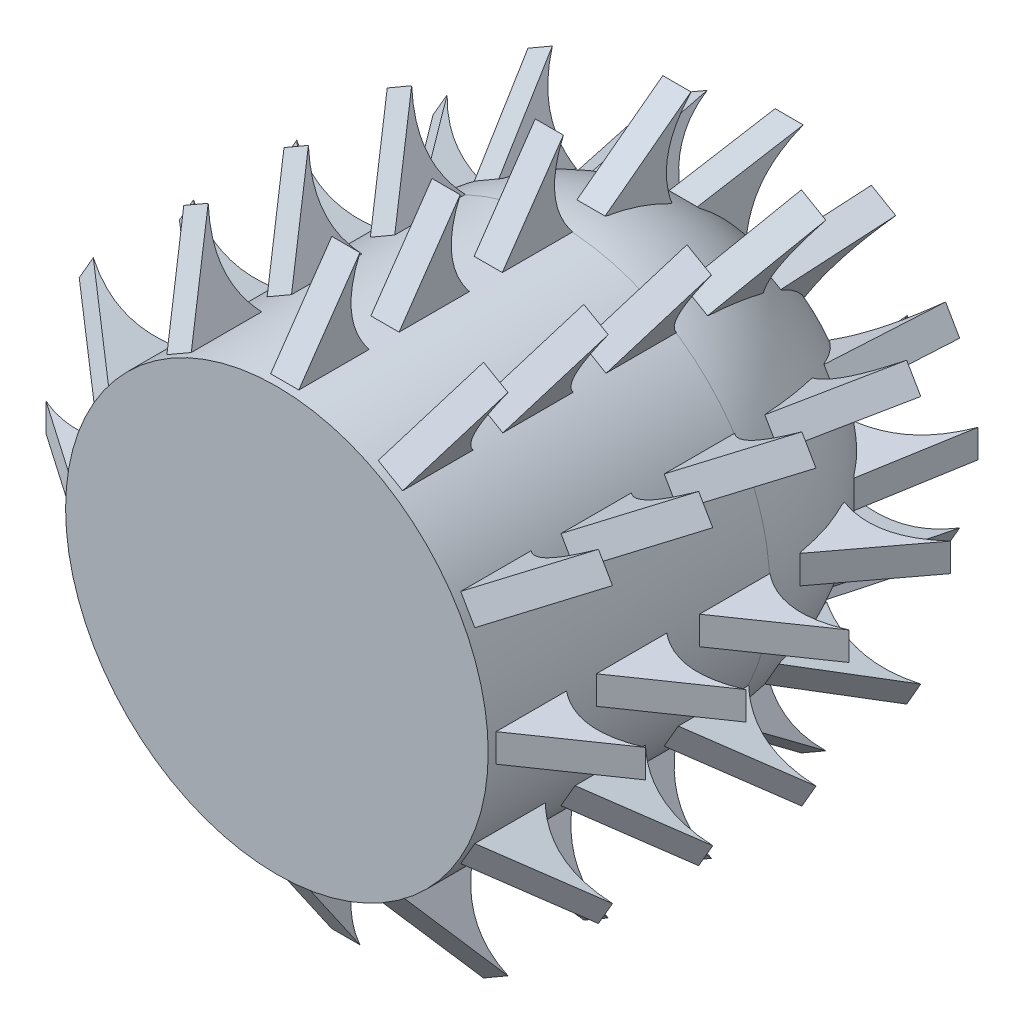
from build123d import *

# Parameters (mm, degrees)
SKETCH_1_R               = 15
EXTRUDE_1_DEPTH          = 20
EXTRUDE_2_DEPTH          = 1
EXTRUDE_2_2_DEPTH        = 1
EXTRUDE_2_3_DEPTH        = 1
EXTRUDE_2_4_DEPTH        = 1
EXTRUDE_2_5_DEPTH        = 1
EXTRUDE_2_6_DEPTH        = 1
PATTERN_CIRCULAR_3_COUNT = 12
PATTERN_CIRCULAR_4_COUNT = 3


with BuildPart() as part:
    # 스케치1 → 보스-돌출1 (new body)
    with BuildSketch(Plane.XY):
        Circle(SKETCH_1_R)
    extrude(amount=EXTRUDE_1_DEPTH)

    # 스케치3 → 회전1 (revolve)
    with BuildSketch(Plane(origin=(0, 0, 0), x_dir=(0, 0, -1), z_dir=(1, 0, 0)), mode=Mode.PRIVATE) as revolve_1_sk:
        with BuildLine():
            Line((0, 15), (0, 0))
            Line((0, 0), (15, 0))
            ThreePointArc((15, 0), (10.606601718, 10.606601718), (0, 15))
        make_face()
    revolve(revolve_1_sk.sketch.rotate(Axis((0, 0, 0), (0, 0, -1)), 180), axis=Axis((0, 0, 0), (0, 0, -1)))


with BuildPart() as body_2:
    # 스케치2 → 보스-돌출2 (new, symmetric)
    with BuildSketch(Plane(origin=(0, 0, 0), x_dir=(1, 0, 0), z_dir=(0, 1, 0))):
        with BuildLine():
            Line((15, -12.327226988), (15, -7.327226988))
            add(Edge.make_bspline(
                [(21.278081575, -7.989280406), (17.730527415, -9.527850561), (15, -7.327226988)],
                knots=[0, 0, 0, 1, 1, 1], degree=2))
            Line((21.278081575, -7.989280406), (15, -12.327226988))
        make_face()
    extrude(amount=EXTRUDE_2_DEPTH, both=True)


with BuildPart() as body_3:
    # 스케치2 → Extrude 2 2 (new, symmetric)
    with BuildSketch(Plane(origin=(0, 0, 0), x_dir=(1, 0, 0), z_dir=(0, 1, 0))):
        with BuildLine():
            Line((15, -5), (15, 0))
            add(Edge.make_bspline(
                [(21.278081575, -0.662053418), (17.730527415, -2.200623572), (15, 0)],
                knots=[0, 0, 0, 1, 1, 1], degree=2))
            Line((21.278081575, -0.662053418), (15, -5))
        make_face()
    extrude(amount=EXTRUDE_2_2_DEPTH, both=True)


with BuildPart() as body_4:
    # 스케치2 → Extrude 2 3 (new, symmetric)
    with BuildSketch(Plane(origin=(0, 0, 0), x_dir=(1, 0, 0), z_dir=(0, 1, 0))):
        with BuildLine():
            Line((12.116597052, 8.842402156), (8.537210737, 12.333532861))
            add(Edge.make_bspline(
                [(13.394680398, 16.365605713), (12.019112737, 12.751722449), (8.537210737, 12.333532861)],
                knots=[0, 0, 0, 1, 1, 1], degree=2))
            Line((13.394680398, 16.365605713), (12.116597052, 8.842402156))
        make_face()
    extrude(amount=EXTRUDE_2_3_DEPTH, both=True)


with BuildPart() as body_5:
    # 스케치2 → Extrude 2 4 (new, symmetric)
    with BuildSketch(Plane(origin=(0, 0, 0), x_dir=(1, 0, 0), z_dir=(0, 1, 0))):
        with BuildLine():
            Line((14.823269639, 2.295795553), (13.245193011, 7.040231679))
            add(Edge.make_bspline(
                [(19.411338622, 8.393476408), (16.530706118, 5.813884383), (13.245193011, 7.040231679)],
                knots=[0, 0, 0, 1, 1, 1], degree=2))
            Line((19.411338622, 8.393476408), (14.823269639, 2.295795553))
        make_face()
    extrude(amount=EXTRUDE_2_4_DEPTH, both=True)


with BuildPart() as body_6:
    # 스케치2 → Extrude 2 5 (new, symmetric)
    with BuildSketch(Plane(origin=(0, 0, 0), x_dir=(1, 0, 0), z_dir=(0, 1, 0))):
        with BuildLine():
            Line((15, -19.442457978), (15, -14.442457978))
            add(Edge.make_bspline(
                [(21.278081575, -15.104511396), (17.730527415, -16.64308155), (15, -14.442457978)],
                knots=[0, 0, 0, 1, 1, 1], degree=2))
            Line((21.278081575, -15.104511396), (15, -19.442457978))
        make_face()
    extrude(amount=EXTRUDE_2_5_DEPTH, both=True)


with BuildPart() as body_7:
    # 스케치2 → Extrude 2 6 (new, symmetric)
    with BuildSketch(Plane(origin=(0, 0, 0), x_dir=(1, 0, 0), z_dir=(0, 1, 0))):
        with BuildLine():
            Line((6.460353009, 13.537497516), (1.652060322, 14.908745645))
            add(Edge.make_bspline(
                [(4.010491166, 20.764548488), (4.51715489, 16.931060454), (1.652060322, 14.908745645)],
                knots=[0, 0, 0, 1, 1, 1], degree=2))
            Line((4.010491166, 20.764548488), (6.460353009, 13.537497516))
        make_face()
    extrude(amount=EXTRUDE_2_6_DEPTH, both=True)


with BuildPart() as pattern_circular_3_1:
    # 원형 패턴3: pattern copy
    add(body_3.part.rotate(Axis((0, 0, 20), (0, 0, -1)), 1 * 360 / PATTERN_CIRCULAR_3_COUNT))


with BuildPart() as pattern_circular_3_2:
    # 원형 패턴3: pattern copy
    add(body_3.part.rotate(Axis((0, 0, 20), (0, 0, -1)), 2 * 360 / PATTERN_CIRCULAR_3_COUNT))


with BuildPart() as pattern_circular_3_3:
    # 원형 패턴3: pattern copy
    add(body_3.part.rotate(Axis((0, 0, 20), (0, 0, -1)), 3 * 360 / PATTERN_CIRCULAR_3_COUNT))


with BuildPart() as pattern_circular_3_4:
    # 원형 패턴3: pattern copy
    add(body_3.part.rotate(Axis((0, 0, 20), (0, 0, -1)), 4 * 360 / PATTERN_CIRCULAR_3_COUNT))


with BuildPart() as pattern_circular_3_5:
    # 원형 패턴3: pattern copy
    add(body_3.part.rotate(Axis((0, 0, 20), (0, 0, -1)), 5 * 360 / PATTERN_CIRCULAR_3_COUNT))


with BuildPart() as pattern_circular_3_6:
    # 원형 패턴3: pattern copy
    add(body_3.part.rotate(Axis((0, 0, 20), (0, 0, -1)), 6 * 360 / PATTERN_CIRCULAR_3_COUNT))


with BuildPart() as pattern_circular_3_7:
    # 원형 패턴3: pattern copy
    add(body_3.part.rotate(Axis((0, 0, 20), (0, 0, -1)), 7 * 360 / PATTERN_CIRCULAR_3_COUNT))


with BuildPart() as pattern_circular_3_8:
    # 원형 패턴3: pattern copy
    add(body_3.part.rotate(Axis((0, 0, 20), (0, 0, -1)), 8 * 360 / PATTERN_CIRCULAR_3_COUNT))


with BuildPart() as pattern_circular_3_9:
    # 원형 패턴3: pattern copy
    add(body_3.part.rotate(Axis((0, 0, 20), (0, 0, -1)), 9 * 360 / PATTERN_CIRCULAR_3_COUNT))


with BuildPart() as pattern_circular_3_10:
    # 원형 패턴3: pattern copy
    add(body_3.part.rotate(Axis((0, 0, 20), (0, 0, -1)), 10 * 360 / PATTERN_CIRCULAR_3_COUNT))


with BuildPart() as pattern_circular_3_11:
    # 원형 패턴3: pattern copy
    add(body_3.part.rotate(Axis((0, 0, 20), (0, 0, -1)), 11 * 360 / PATTERN_CIRCULAR_3_COUNT))


with BuildPart() as pattern_circular_3_12:
    # 원형 패턴3: pattern copy
    add(body_2.part.rotate(Axis((0, 0, 20), (0, 0, -1)), 1 * 360 / PATTERN_CIRCULAR_3_COUNT))


with BuildPart() as pattern_circular_3_13:
    # 원형 패턴3: pattern copy
    add(body_2.part.rotate(Axis((0, 0, 20), (0, 0, -1)), 2 * 360 / PATTERN_CIRCULAR_3_COUNT))


with BuildPart() as pattern_circular_3_14:
    # 원형 패턴3: pattern copy
    add(body_2.part.rotate(Axis((0, 0, 20), (0, 0, -1)), 3 * 360 / PATTERN_CIRCULAR_3_COUNT))


with BuildPart() as pattern_circular_3_15:
    # 원형 패턴3: pattern copy
    add(body_2.part.rotate(Axis((0, 0, 20), (0, 0, -1)), 4 * 360 / PATTERN_CIRCULAR_3_COUNT))


with BuildPart() as pattern_circular_3_16:
    # 원형 패턴3: pattern copy
    add(body_2.part.rotate(Axis((0, 0, 20), (0, 0, -1)), 5 * 360 / PATTERN_CIRCULAR_3_COUNT))


with BuildPart() as pattern_circular_3_17:
    # 원형 패턴3: pattern copy
    add(body_2.part.rotate(Axis((0, 0, 20), (0, 0, -1)), 6 * 360 / PATTERN_CIRCULAR_3_COUNT))


with BuildPart() as pattern_circular_3_18:
    # 원형 패턴3: pattern copy
    add(body_2.part.rotate(Axis((0, 0, 20), (0, 0, -1)), 7 * 360 / PATTERN_CIRCULAR_3_COUNT))


with BuildPart() as pattern_circular_3_19:
    # 원형 패턴3: pattern copy
    add(body_2.part.rotate(Axis((0, 0, 20), (0, 0, -1)), 8 * 360 / PATTERN_CIRCULAR_3_COUNT))


with BuildPart() as pattern_circular_3_20:
    # 원형 패턴3: pattern copy
    add(body_2.part.rotate(Axis((0, 0, 20), (0, 0, -1)), 9 * 360 / PATTERN_CIRCULAR_3_COUNT))


with BuildPart() as pattern_circular_3_21:
    # 원형 패턴3: pattern copy
    add(body_2.part.rotate(Axis((0, 0, 20), (0, 0, -1)), 10 * 360 / PATTERN_CIRCULAR_3_COUNT))


with BuildPart() as pattern_circular_3_22:
    # 원형 패턴3: pattern copy
    add(body_2.part.rotate(Axis((0, 0, 20), (0, 0, -1)), 11 * 360 / PATTERN_CIRCULAR_3_COUNT))


with BuildPart() as pattern_circular_3_23:
    # 원형 패턴3: pattern copy
    add(body_6.part.rotate(Axis((0, 0, 20), (0, 0, -1)), 1 * 360 / PATTERN_CIRCULAR_3_COUNT))


with BuildPart() as pattern_circular_3_24:
    # 원형 패턴3: pattern copy
    add(body_6.part.rotate(Axis((0, 0, 20), (0, 0, -1)), 2 * 360 / PATTERN_CIRCULAR_3_COUNT))


with BuildPart() as pattern_circular_3_25:
    # 원형 패턴3: pattern copy
    add(body_6.part.rotate(Axis((0, 0, 20), (0, 0, -1)), 3 * 360 / PATTERN_CIRCULAR_3_COUNT))


with BuildPart() as pattern_circular_3_26:
    # 원형 패턴3: pattern copy
    add(body_6.part.rotate(Axis((0, 0, 20), (0, 0, -1)), 4 * 360 / PATTERN_CIRCULAR_3_COUNT))


with BuildPart() as pattern_circular_3_27:
    # 원형 패턴3: pattern copy
    add(body_6.part.rotate(Axis((0, 0, 20), (0, 0, -1)), 5 * 360 / PATTERN_CIRCULAR_3_COUNT))


with BuildPart() as pattern_circular_3_28:
    # 원형 패턴3: pattern copy
    add(body_6.part.rotate(Axis((0, 0, 20), (0, 0, -1)), 6 * 360 / PATTERN_CIRCULAR_3_COUNT))


with BuildPart() as pattern_circular_3_29:
    # 원형 패턴3: pattern copy
    add(body_6.part.rotate(Axis((0, 0, 20), (0, 0, -1)), 7 * 360 / PATTERN_CIRCULAR_3_COUNT))


with BuildPart() as pattern_circular_3_30:
    # 원형 패턴3: pattern copy
    add(body_6.part.rotate(Axis((0, 0, 20), (0, 0, -1)), 8 * 360 / PATTERN_CIRCULAR_3_COUNT))


with BuildPart() as pattern_circular_3_31:
    # 원형 패턴3: pattern copy
    add(body_6.part.rotate(Axis((0, 0, 20), (0, 0, -1)), 9 * 360 / PATTERN_CIRCULAR_3_COUNT))


with BuildPart() as pattern_circular_3_32:
    # 원형 패턴3: pattern copy
    add(body_6.part.rotate(Axis((0, 0, 20), (0, 0, -1)), 10 * 360 / PATTERN_CIRCULAR_3_COUNT))


with BuildPart() as pattern_circular_3_33:
    # 원형 패턴3: pattern copy
    add(body_6.part.rotate(Axis((0, 0, 20), (0, 0, -1)), 11 * 360 / PATTERN_CIRCULAR_3_COUNT))


with BuildPart() as pattern_circular_3_34:
    # 원형 패턴3: pattern copy
    add(body_4.part.rotate(Axis((0, 0, 20), (0, 0, -1)), 1 * 360 / PATTERN_CIRCULAR_3_COUNT))


with BuildPart() as pattern_circular_3_35:
    # 원형 패턴3: pattern copy
    add(body_4.part.rotate(Axis((0, 0, 20), (0, 0, -1)), 2 * 360 / PATTERN_CIRCULAR_3_COUNT))


with BuildPart() as pattern_circular_3_36:
    # 원형 패턴3: pattern copy
    add(body_4.part.rotate(Axis((0, 0, 20), (0, 0, -1)), 3 * 360 / PATTERN_CIRCULAR_3_COUNT))


with BuildPart() as pattern_circular_3_37:
    # 원형 패턴3: pattern copy
    add(body_4.part.rotate(Axis((0, 0, 20), (0, 0, -1)), 4 * 360 / PATTERN_CIRCULAR_3_COUNT))


with BuildPart() as pattern_circular_3_38:
    # 원형 패턴3: pattern copy
    add(body_4.part.rotate(Axis((0, 0, 20), (0, 0, -1)), 5 * 360 / PATTERN_CIRCULAR_3_COUNT))


with BuildPart() as pattern_circular_3_39:
    # 원형 패턴3: pattern copy
    add(body_4.part.rotate(Axis((0, 0, 20), (0, 0, -1)), 6 * 360 / PATTERN_CIRCULAR_3_COUNT))


with BuildPart() as pattern_circular_3_40:
    # 원형 패턴3: pattern copy
    add(body_4.part.rotate(Axis((0, 0, 20), (0, 0, -1)), 7 * 360 / PATTERN_CIRCULAR_3_COUNT))


with BuildPart() as pattern_circular_3_41:
    # 원형 패턴3: pattern copy
    add(body_4.part.rotate(Axis((0, 0, 20), (0, 0, -1)), 8 * 360 / PATTERN_CIRCULAR_3_COUNT))


with BuildPart() as pattern_circular_3_42:
    # 원형 패턴3: pattern copy
    add(body_4.part.rotate(Axis((0, 0, 20), (0, 0, -1)), 9 * 360 / PATTERN_CIRCULAR_3_COUNT))


with BuildPart() as pattern_circular_3_43:
    # 원형 패턴3: pattern copy
    add(body_4.part.rotate(Axis((0, 0, 20), (0, 0, -1)), 10 * 360 / PATTERN_CIRCULAR_3_COUNT))


with BuildPart() as pattern_circular_3_44:
    # 원형 패턴3: pattern copy
    add(body_4.part.rotate(Axis((0, 0, 20), (0, 0, -1)), 11 * 360 / PATTERN_CIRCULAR_3_COUNT))


with BuildPart() as pattern_circular_3_45:
    # 원형 패턴3: pattern copy
    add(body_5.part.rotate(Axis((0, 0, 20), (0, 0, -1)), 1 * 360 / PATTERN_CIRCULAR_3_COUNT))


with BuildPart() as pattern_circular_3_46:
    # 원형 패턴3: pattern copy
    add(body_5.part.rotate(Axis((0, 0, 20), (0, 0, -1)), 2 * 360 / PATTERN_CIRCULAR_3_COUNT))


with BuildPart() as pattern_circular_3_47:
    # 원형 패턴3: pattern copy
    add(body_5.part.rotate(Axis((0, 0, 20), (0, 0, -1)), 3 * 360 / PATTERN_CIRCULAR_3_COUNT))


with BuildPart() as pattern_circular_3_48:
    # 원형 패턴3: pattern copy
    add(body_5.part.rotate(Axis((0, 0, 20), (0, 0, -1)), 4 * 360 / PATTERN_CIRCULAR_3_COUNT))


with BuildPart() as pattern_circular_3_49:
    # 원형 패턴3: pattern copy
    add(body_5.part.rotate(Axis((0, 0, 20), (0, 0, -1)), 5 * 360 / PATTERN_CIRCULAR_3_COUNT))


with BuildPart() as pattern_circular_3_50:
    # 원형 패턴3: pattern copy
    add(body_5.part.rotate(Axis((0, 0, 20), (0, 0, -1)), 6 * 360 / PATTERN_CIRCULAR_3_COUNT))


with BuildPart() as pattern_circular_3_51:
    # 원형 패턴3: pattern copy
    add(body_5.part.rotate(Axis((0, 0, 20), (0, 0, -1)), 7 * 360 / PATTERN_CIRCULAR_3_COUNT))


with BuildPart() as pattern_circular_3_52:
    # 원형 패턴3: pattern copy
    add(body_5.part.rotate(Axis((0, 0, 20), (0, 0, -1)), 8 * 360 / PATTERN_CIRCULAR_3_COUNT))


with BuildPart() as pattern_circular_3_53:
    # 원형 패턴3: pattern copy
    add(body_5.part.rotate(Axis((0, 0, 20), (0, 0, -1)), 9 * 360 / PATTERN_CIRCULAR_3_COUNT))

    # Combine 3: union 원형 패턴3_42, part
    add(pattern_circular_3_42.part)
    add(part.part)


with BuildPart() as pattern_circular_3_54:
    # 원형 패턴3: pattern copy
    add(body_5.part.rotate(Axis((0, 0, 20), (0, 0, -1)), 10 * 360 / PATTERN_CIRCULAR_3_COUNT))


with BuildPart() as pattern_circular_3_55:
    # 원형 패턴3: pattern copy
    add(body_5.part.rotate(Axis((0, 0, 20), (0, 0, -1)), 11 * 360 / PATTERN_CIRCULAR_3_COUNT))


with BuildPart() as pattern_circular_4_1:
    # 원형 패턴4: pattern copy
    add(body_7.part.rotate(Axis((0, 0, 20), (0, 0, -1)), 1 * 360 / PATTERN_CIRCULAR_4_COUNT))


with BuildPart() as pattern_circular_4_2:
    # 원형 패턴4: pattern copy
    add(body_7.part.rotate(Axis((0, 0, 20), (0, 0, -1)), 2 * 360 / PATTERN_CIRCULAR_4_COUNT))


solid = Compound([body_2.part, body_3.part, body_4.part, body_5.part, body_6.part, body_7.part, pattern_circular_3_1.part, pattern_circular_3_2.part, pattern_circular_3_3.part, pattern_circular_3_4.part, pattern_circular_3_5.part, pattern_circular_3_6.part, pattern_circular_3_7.part, pattern_circular_3_8.part, pattern_circular_3_9.part, pattern_circular_3_10.part, pattern_circular_3_11.part, pattern_circular_3_12.part, pattern_circular_3_13.part, pattern_circular_3_14.part, pattern_circular_3_15.part, pattern_circular_3_16.part, pattern_circular_3_17.part, pattern_circular_3_18.part, pattern_circular_3_19.part, pattern_circular_3_20.part, pattern_circular_3_21.part, pattern_circular_3_22.part, pattern_circular_3_23.part, pattern_circular_3_24.part, pattern_circular_3_25.part, pattern_circular_3_26.part, pattern_circular_3_27.part, pattern_circular_3_28.part, pattern_circular_3_29.part, pattern_circular_3_30.part, pattern_circular_3_31.part, pattern_circular_3_32.part, pattern_circular_3_33.part, pattern_circular_3_34.part, pattern_circular_3_35.part, pattern_circular_3_36.part, pattern_circular_3_37.part, pattern_circular_3_38.part, pattern_circular_3_39.part, pattern_circular_3_40.part, pattern_circular_3_41.part, pattern_circular_3_43.part, pattern_circular_3_44.part, pattern_circular_3_45.part, pattern_circular_3_46.part, pattern_circular_3_47.part, pattern_circular_3_48.part, pattern_circular_3_49.part, pattern_circular_3_50.part, pattern_circular_3_51.part, pattern_circular_3_52.part, pattern_circular_3_53.part, pattern_circular_3_54.part, pattern_circular_3_55.part, pattern_circular_4_1.part, pattern_circular_4_2.part])
